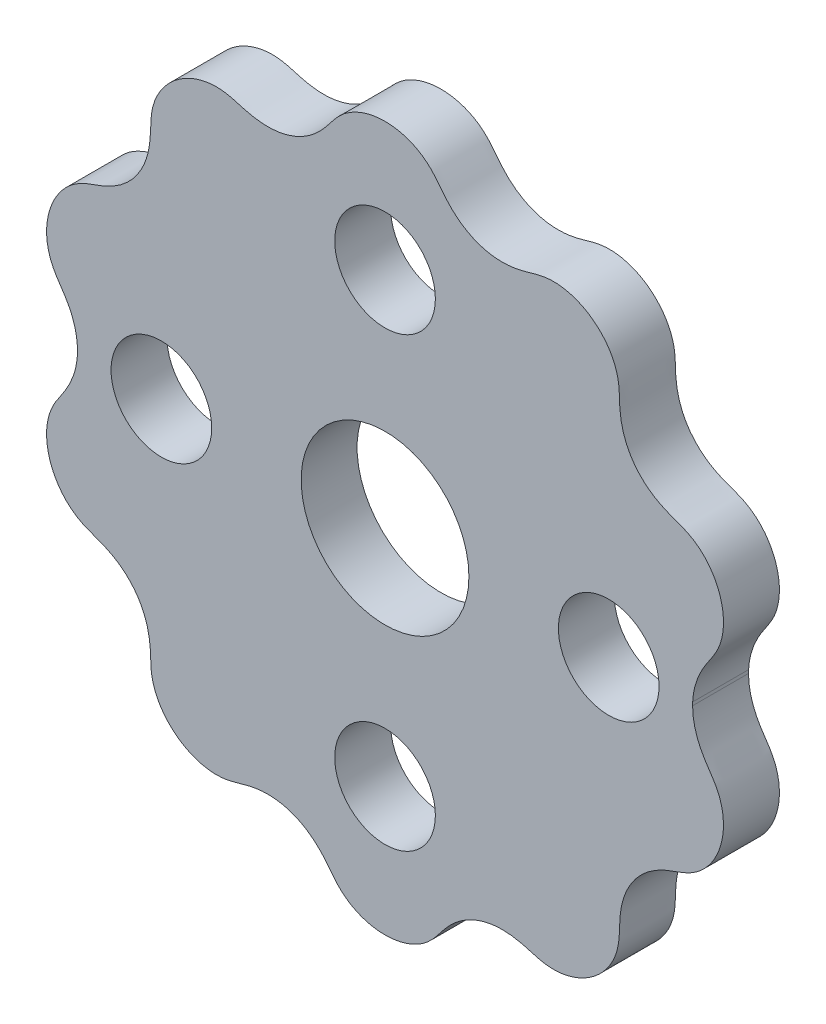
from build123d import *

# Parameters (mm, degrees)
BOSS_EXTRUDE1_DEPTH = 5
SKETCH3_R           = 7.5
CUT_EXTRUDE1_DEPTH  = 5
SKETCH4_R           = 4.5
CUT_EXTRUDE2_DEPTH  = 5


with BuildPart() as part:
    # Sketch2 → Boss-Extrude1 (new body)
    with BuildSketch(Plane.XY):
        with BuildLine():
            add(Edge.make_bspline(
                [(27.5, 0), (27.5, -0.04899217), (27.50135866, -0.145980801), (27.507472654, -0.339982279), (27.523756925, -0.570047647), (27.548133929, -0.791785096), (27.580543941, -1.016646016), (27.620906624, -1.240455333), (27.669120401, -1.462120318), (27.725061331, -1.682048112), (27.788581513, -1.899959083), (27.87723987, -2.16945037), (27.998047594, -2.487837294), (28.158992275, -2.851172113), (28.371216221, -3.260760334), (28.609496874, -3.664071589), (28.869547917, -4.062199399), (29.142983154, -4.459848636), (29.410606359, -4.861593026), (29.652914601, -5.27958699), (29.909394747, -5.826537984), (30.172150712, -6.632835686), (30.320330137, -7.718326385), (30.208932651, -9.061422993), (29.749092141, -10.464091162), (29.033932991, -11.624574121), (28.248126213, -12.425056122), (27.533347436, -12.923861083), (26.979258064, -13.213448171), (26.517958047, -13.406233161), (26.04776714, -13.574563835), (25.577712412, -13.7437073), (24.825090037, -14.04291038), (23.827217442, -14.561098484), (22.861879466, -15.334082504), (22.040788621, -16.383811215), (21.528118141, -17.376533007), (21.228550237, -18.232801464), (21.066860687, -19.017050522), (20.994517463, -19.706566829), (20.967099781, -20.292836156), (20.954787651, -20.773593995), (20.933778384, -21.254199064), (20.881616978, -21.732873579), (20.764492767, -22.323349948), (20.499566135, -23.12579641), (19.979007228, -24.085143815), (19.097331302, -25.101593868), (17.898246601, -25.962240434), (16.633463883, -26.477456981), (15.397891194, -26.678773779), (14.395919298, -26.623352055), (13.660337246, -26.459308742), (12.939381013, -26.246796934), (12.037894225, -25.987331765), (10.799530559, -25.776341191), (9.434774247, -25.850566789), (8.155026622, -26.227668412), (7.161489216, -26.736944431), (6.422239126, -27.256866119), (5.748947606, -27.878256719), (5.222918193, -28.4924395), (4.800117167, -29.051463242), (4.42879569, -29.516136265), (4.10756511, -29.86774765), (3.669485672, -30.271013184), (2.985379518, -30.761784692), (1.999420221, -31.231406385), (0.68516587, -31.534650673), (-0.798205604, -31.522656113), (-2.128615505, -31.189938616), (-3.135413349, -30.677103573), (-3.82958727, -30.139799491), (-4.274055959, -29.693957627), (-4.598457724, -29.309039614), (-4.904758838, -28.910227269), (-5.214354414, -28.513705816), (-5.739832162, -27.8897576), (-6.556207038, -27.104472974), (-7.604498456, -26.437108519), (-8.866795762, -25.999525451), (-9.970418078, -25.836301198), (-10.871148026, -25.828901412), (-11.777165475, -25.941010531), (-12.560048382, -26.131538667), (-13.227934503, -26.335361352), (-13.799901689, -26.490376768), (-14.26522164, -26.582977584), (-14.854825422, -26.647871085), (-15.693533833, -26.638131044), (-16.762285657, -26.434441739), (-18.004572962, -25.901871355), (-19.202392537, -25.00893244), (-20.089310365, -23.935714997), (-20.601734095, -22.898917155), (-20.838044071, -22.028621594), (-20.924706566, -21.383363928), (-20.952801811, -20.863710634), (-20.96819599, -20.213817255), (-21.01631244, -19.275126767), (-21.232207201, -18.058124945), (-21.748306978, -16.823469899), (-22.502170081, -15.769869921), (-23.289800172, -15.010193932), (-24.015474904, -14.481793444), (-24.814179253, -14.046249047), (-25.558161605, -13.744789797), (-26.216044268, -13.518355163), (-26.877255565, -13.264228871), (-27.512865113, -12.947453785), (-28.292872306, -12.394170003), (-29.112459011, -11.514008548), (-29.799243603, -10.352435058), (-30.182686666, -9.107591771), (-30.294266249, -7.986834397), (-30.221692293, -6.966740629), (-30.022653879, -6.083885018), (-29.691185023, -5.302853172), (-29.269244355, -4.641732216), (-28.824111069, -3.998224618), (-28.312379876, -3.205638073), (-27.776193235, -2.08704254), (-27.474652632, -0.769312565), (-27.478290084, 0.548325486), (-27.69001683, 1.652399406), (-27.994954116, 2.536570728), (-28.413105114, 3.366699758), (-28.914377217, 4.140481), (-29.447806729, 4.885355759), (-29.875490711, 5.694050512), (-30.189386197, 6.688392203), (-30.317842311, 7.85341256), (-30.186732607, 9.145264959), (-29.730040062, 10.490578333), (-29.054068555, 11.585424729), (-28.260797371, 12.416094066), (-27.430755725, 13.002678894), (-26.62984203, 13.379423564), (-25.785609625, 13.659898713), (-24.948326578, 13.985991882), (-24.141321444, 14.402828102), (-23.389141188, 14.927315645), (-22.574243756, 15.684157272), (-21.793446903, 16.7389094), (-21.254569184, 17.980410903), (-21.023931113, 19.206999551), (-20.969799668, 20.155296748), (-20.954262277, 20.813198115), (-20.92863053, 21.339392572), (-20.845804659, 21.993172379), (-20.613532779, 22.870323537), (-20.104987014, 23.91191074), (-19.223516425, 24.988043106), (-18.036257619, 25.882270163), (-16.804585096, 26.420383437), (-15.629353645, 26.653788326), (-14.557544601, 26.648603446), (-13.629892759, 26.465722207), (-12.746408377, 26.179332035), (-11.85561661, 25.957331232), (-10.957335429, 25.834490601), (-10.062275579, 25.830404882), (-8.978299212, 25.974061157), (-7.744935026, 26.375246441), (-6.594542371, 27.064617132), (-5.697285904, 27.92053444), (-5.102128848, 28.652048875), (-4.627903549, 29.274054081), (-4.129273858, 29.879120318), (-3.344651736, 30.560327081), (-2.203708507, 31.165515183), (-0.854130087, 31.51718995), (0.639569762, 31.539632605), (1.956728735, 31.244851744), (3.047227561, 30.736620441), (3.814470706, 30.165040248), (4.311966667, 29.657876957), (4.757978081, 29.107124397), (5.176739636, 28.551256817), (5.694035861, 27.936796936), (6.518625784, 27.157952455), (7.623896654, 26.428735065), (9.059079107, 25.899970885), (10.61800797, 25.773492163), (11.841701099, 25.944918843), (12.748783199, 26.18950086), (13.371444632, 26.375598564), (13.874196564, 26.509201798), (14.514501534, 26.62572373), (15.414903431, 26.669333724), (16.558774471, 26.501865833), (17.853098114, 25.989603987), (19.072183707, 25.125932986), (19.962359733, 24.108495101), (20.48608855, 23.154342422), (20.754152378, 22.359200107), (20.874295701, 21.77807522), (20.929743059, 21.306681605), (20.958832115, 20.714549688), (20.971466064, 20.016086385), (21.032602862, 19.212352135), (21.206619139, 18.315806423), (21.492768161, 17.461355954), (21.989932448, 16.462544158), (22.796985821, 15.398098246), (23.755999115, 14.6083126), (24.755065293, 14.075414997), (25.510689165, 13.76889927), (25.983327536, 13.597148379), (26.457070471, 13.429078659), (26.92312452, 13.239330277), (27.484095558, 12.954136339), (28.209029352, 12.459711173), (29.007164713, 11.660589127), (29.734149434, 10.498038041), (30.203457883, 9.090834477), (30.310275415, 7.866516893), (30.209433636, 6.901488775), (30.031052755, 6.202428639), (29.872474757, 5.753051872), (29.673653477, 5.319938511), (29.438083984, 4.905859039), (29.176233755, 4.508293873), (28.906407754, 4.116345418), (28.647626429, 3.72437827), (28.408685192, 3.32722084), (28.194278473, 2.923344084), (28.006934286, 2.51305946), (27.866343861, 2.144303687), (27.763699109, 1.822032249), (27.690514228, 1.550000941), (27.639533813, 1.33054248), (27.596240396, 1.10883748), (27.56075827, 0.886148585), (27.533233856, 0.666460317), (27.518171139, 0.491124062), (27.510721259, 0.364271535), (27.507694029, 0.30244702), (27.507531997, 0.299100054)],
                knots=[0.068157407, 0.068157407, 0.068157407, 0.068157407, 0.068157407, 0.069101513, 0.070045619, 0.070989724, 0.07193383, 0.072877936, 0.073822042, 0.074766147, 0.075710253, 0.076654359, 0.077598465, 0.079486676, 0.081374888, 0.083263099, 0.085271096, 0.087279092, 0.089287089, 0.091295086, 0.093303082, 0.095311079, 0.099327072, 0.105359999, 0.111392927, 0.11753245, 0.123671973, 0.127828107, 0.129906174, 0.131984241, 0.134062308, 0.136140375, 0.138218442, 0.140296509, 0.147539835, 0.154783161, 0.158545746, 0.162308331, 0.166070917, 0.169833502, 0.171834535, 0.173835569, 0.175836602, 0.177837635, 0.179838668, 0.181839701, 0.185841768, 0.191852887, 0.197864006, 0.204025484, 0.210186961, 0.214357524, 0.218528086, 0.220613367, 0.222698648, 0.22686921, 0.23413903, 0.24140885, 0.245157767, 0.248906684, 0.252655602, 0.256404519, 0.260363032, 0.262342289, 0.264321545, 0.266300802, 0.268280059, 0.272238572, 0.278286821, 0.28433507, 0.290518432, 0.296701794, 0.300886896, 0.302979447, 0.305071997, 0.307164548, 0.309257099, 0.31134965, 0.313442201, 0.320738299, 0.328034398, 0.331770686, 0.335506973, 0.33924326, 0.342979547, 0.346922971, 0.348894682, 0.350866394, 0.352838106, 0.354809818, 0.358753241, 0.364779687, 0.370806133, 0.377097046, 0.38338796, 0.387715945, 0.389879938, 0.39204393, 0.394207923, 0.396371915, 0.4006999, 0.407679847, 0.414659795, 0.418383523, 0.422107252, 0.42583098, 0.429554709, 0.433483029, 0.435447188, 0.437411348, 0.441339668, 0.445267988, 0.45127261, 0.457277232, 0.463590346, 0.466746903, 0.46990346, 0.474246235, 0.478589011, 0.480760399, 0.482931786, 0.487274562, 0.494279749, 0.501284935, 0.505163922, 0.509042909, 0.512921896, 0.516800884, 0.520588124, 0.524375364, 0.528162604, 0.531949845, 0.537849068, 0.54374829, 0.549575688, 0.555403086, 0.559069763, 0.562736441, 0.566403118, 0.570069796, 0.573873027, 0.577676258, 0.58147949, 0.585282721, 0.592319349, 0.599355976, 0.603737329, 0.605928006, 0.608118682, 0.610309359, 0.612500036, 0.616881389, 0.6231544, 0.629427411, 0.635412582, 0.641397753, 0.645312823, 0.649227894, 0.653142965, 0.657058036, 0.660770425, 0.664482815, 0.668195205, 0.671907594, 0.678910036, 0.685912478, 0.690253637, 0.692424216, 0.694594795, 0.698935954, 0.703277113, 0.70958781, 0.715898506, 0.72190551, 0.727912514, 0.73184247, 0.735772425, 0.737737403, 0.739702381, 0.743632337, 0.747357444, 0.751082551, 0.758532766, 0.765509949, 0.772487132, 0.776813508, 0.778976695, 0.781139883, 0.783303071, 0.785466259, 0.789792635, 0.79608112, 0.802369606, 0.808398432, 0.814427257, 0.818372343, 0.820344885, 0.822317428, 0.824289971, 0.826262514, 0.830207599, 0.833945246, 0.837682893, 0.84142054, 0.845158186, 0.852451428, 0.859744671, 0.861836426, 0.863928181, 0.866019936, 0.868111692, 0.870203447, 0.872295202, 0.876478712, 0.882659691, 0.888840669, 0.894891295, 0.900941921, 0.902921924, 0.904901927, 0.906881931, 0.908861934, 0.910841937, 0.91282194, 0.914801943, 0.916781947, 0.918657172, 0.920532398, 0.922407623, 0.924282849, 0.925220462, 0.926158075, 0.927095687, 0.9280333, 0.928970913, 0.929908526, 0.930846139, 0.930899985, 0.930899985, 0.930899985, 0.930899985, 0.930899985], degree=4))
            add(Edge.make_bspline(
                [(27.5, 0), (27.499962152, 0.050286846), (27.50080044, 0.100555355)],
                knots=[0, 0, 0, 0.336071924, 0.336071924, 0.336071924], degree=2))
            add(Edge.make_bspline(
                [(27.507531997, 0.299100054), (27.504872602, 0.24416695), (27.502853578, 0.19212297), (27.501530505, 0.146410555), (27.50080044, 0.100555355)],
                knots=[0.930899985, 0.930899985, 0.930899985, 0.930899985, 0.930899985, 0.931783751, 0.931783751, 0.931783751, 0.931783751, 0.931783751], degree=4))
        make_face()
    extrude(amount=BOSS_EXTRUDE1_DEPTH)

    # Sketch3 → Cut-Extrude1 (cut)
    with BuildSketch(Plane.XY.offset(5)):
        Circle(SKETCH3_R)
    extrude(amount=-CUT_EXTRUDE1_DEPTH, mode=Mode.SUBTRACT)

    # Sketch4 → Cut-Extrude2 (cut)
    with BuildSketch(Plane.XY.offset(5)):
        with Locations((20, 0)):
            Circle(SKETCH4_R)
        with Locations((0, -20)):
            Circle(SKETCH4_R)
        with Locations((-20, 0)):
            Circle(SKETCH4_R)
        with Locations((0, 20)):
            Circle(SKETCH4_R)
    extrude(amount=-CUT_EXTRUDE2_DEPTH, mode=Mode.SUBTRACT)


solid = part.part
